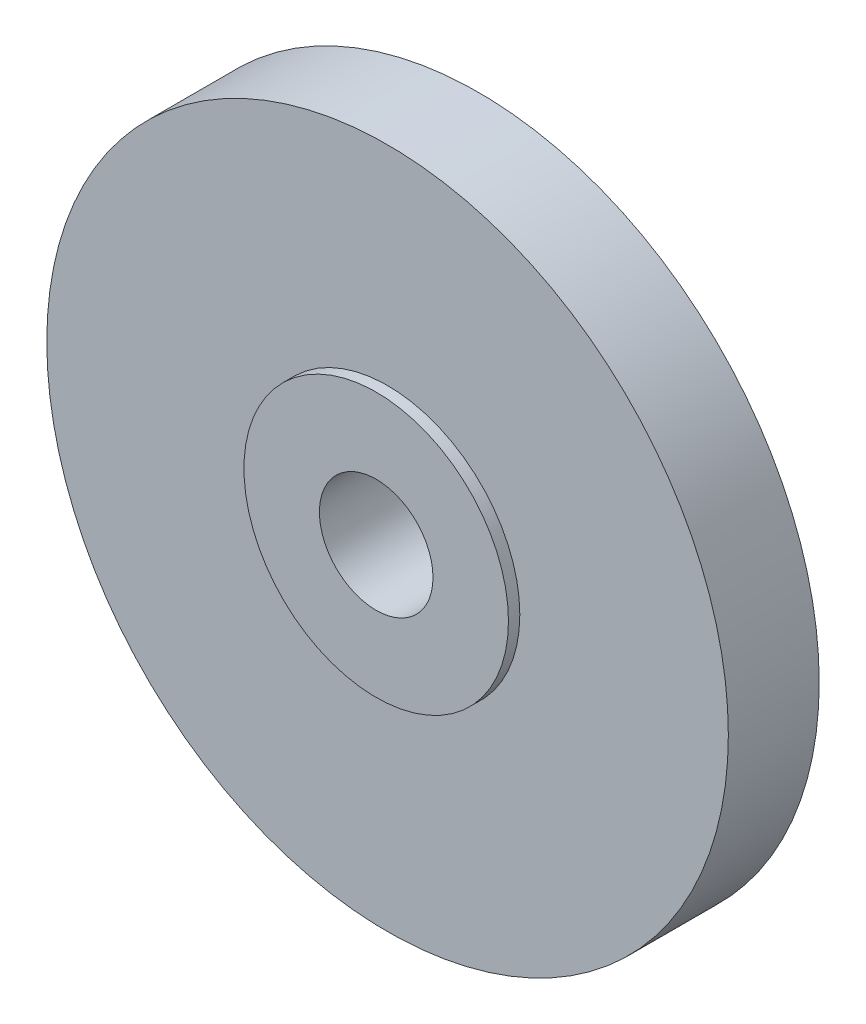
from build123d import *

# Parameters (mm, degrees)
CROQUIS1_R              = 300
SALIENTE_EXTRUIR1_DEPTH = 80
CROQUIS2_R              = 116.43
SALIENTE_EXTRUIR2_DEPTH = 10
CROQUIS3_R              = 50
CORTAR_EXTRUIR2_DEPTH   = 90


with BuildPart() as part:
    # Croquis1 → Saliente-Extruir1 (new body)
    with BuildSketch(Plane.XY):
        with Locations((-32.211835662, 9.092266462)):
            Circle(CROQUIS1_R)
    extrude(amount=SALIENTE_EXTRUIR1_DEPTH)

    # Croquis2 → Saliente-Extruir2 (add)
    with BuildSketch(Plane.XY.offset(80)):
        with Locations((-32.211835662, 9.092266462)):
            Circle(CROQUIS2_R)
    extrude(amount=SALIENTE_EXTRUIR2_DEPTH)

    # Croquis3 → Cortar-Extruir2 (cut)
    with BuildSketch(Plane.XY.offset(90)):
        with Locations((-32.211835662, 9.092266462)):
            Circle(CROQUIS3_R)
    extrude(amount=-CORTAR_EXTRUIR2_DEPTH, mode=Mode.SUBTRACT)


solid = part.part
